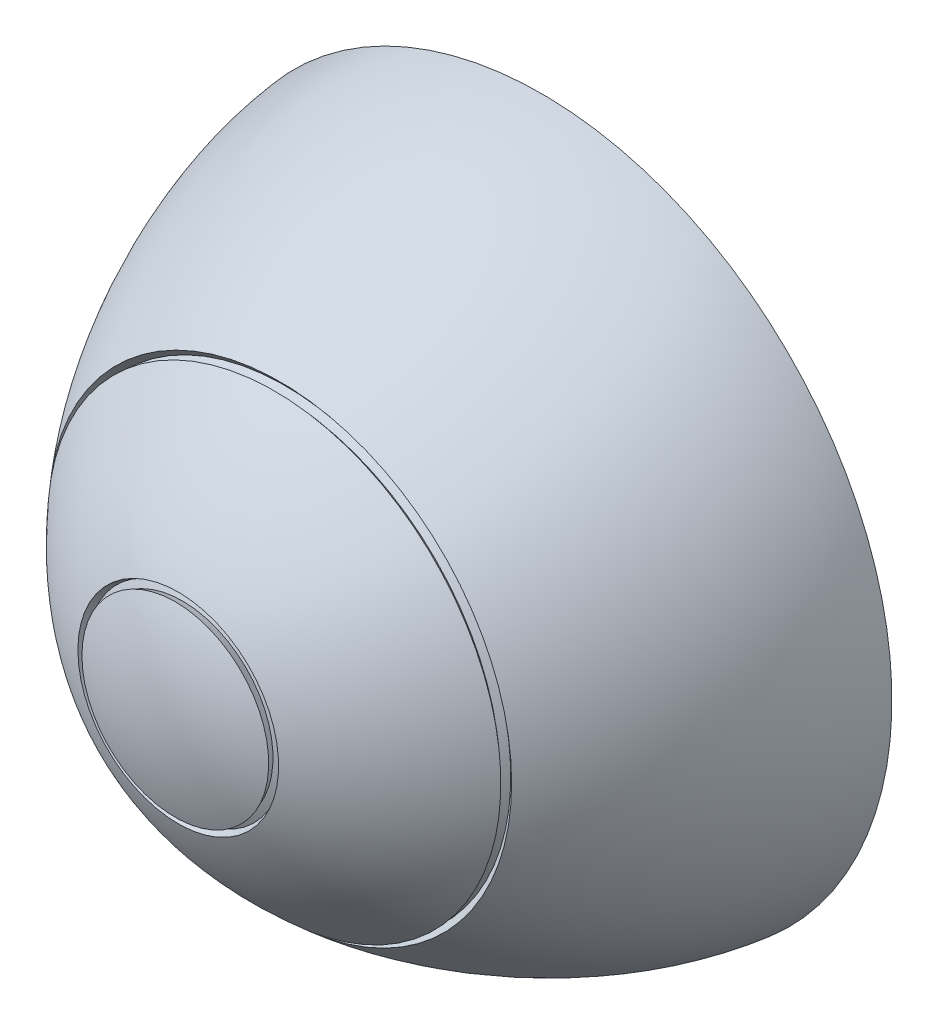
from build123d import *


with BuildPart() as part:
    # Esboço1 → Revolução1 (revolve)
    with BuildSketch(Plane(origin=(0, 0, 0), x_dir=(0, 0, -1), z_dir=(1, 0, 0))):
        with BuildLine():
            Line((-9.9, 0), (0, 0))
            Line((0, 0), (0, 9))
            add(Edge.make_bspline(
                [(-9.9, 0), (-9.909983233, 4.865844561), (-4.030430742, 8.598672438), (0, 9)],
                knots=[0, 0, 0, 0, 1, 1, 1, 1], degree=3))
        make_face()
    revolve(axis=Axis((0, 0, -0.495249581), (0, 0, 1)))

    # Esboço2 → Corte-Revolução1 (revolve, cut)
    with BuildSketch(Plane(origin=(0, 0, 0), x_dir=(0, 0, -1), z_dir=(1, 0, 0))):
        with BuildLine():
            Line((-4, 5.469953061), (-4, 0))
            Line((-4, 0), (1, 0))
            Line((1, 0), (1, 7.09390119))
            add(Edge.make_bspline(
                [(1, 7.09390119), (0.241512964, 7.01284271), (0.209991891, 7.011809212), (0.086311605, 6.997699099), (0.057571185, 6.994232877), (-0.027522658, 6.983363535), (-0.084931827, 6.975254523), (-0.257903575, 6.948559915), (-0.374697634, 6.927544949), (-0.727785948, 6.85558027), (-0.966699441, 6.795740091), (-1.684998489, 6.585696706), (-2.16561255, 6.405303013), (-3.103396143, 5.982045517), (-3.561210819, 5.739533633), (-4, 5.469953061)],
                knots=[-0.018640512, -0.018640512, -0.018640512, -0.018640512, 0.0078125, 0.0078125, 0.015625, 0.015625, 0.03125, 0.03125, 0.0625, 0.0625, 0.125, 0.125, 0.25, 0.25, 0.374605818, 0.374605818, 0.374605818, 0.374605818], degree=3))
        make_face()
    revolve(axis=Axis((0, 0, -0.495249581), (0, 0, 1)), mode=Mode.SUBTRACT)

    # Esboço4 → Corte-Revolução2 (revolve, cut)
    with BuildSketch(Plane(origin=(0, 0, 0), x_dir=(0, 0, -1), z_dir=(1, 0, 0))):
        with BuildLine():
            Line((-7.010691462, 5.975922882), (-6.746324533, 5.675729353))
            add(Edge.make_bspline(
                [(-6.6, 5.802525488), (-6.64911679, 5.760642692), (-6.697896572, 5.718377678), (-6.746324533, 5.675729353)],
                knots=[0.518643322, 0.518643322, 0.518643322, 0.518643322, 0.532269657, 0.532269657, 0.532269657, 0.532269657], degree=3))
            Line((-6.6, 5.802525488), (-6.859541532, 6.106895011))
            add(Edge.make_bspline(
                [(-6.859541532, 6.106895011), (-6.910263, 6.063645619), (-6.960651247, 6.019989162), (-7.010691462, 5.975922882)],
                knots=[0.518640951, 0.518640951, 0.518640951, 0.518640951, 0.532267119, 0.532267119, 0.532267119, 0.532267119], degree=3))
        make_face()
    revolve(axis=Axis((0, 0, -0.495249581), (0, 0, 1)), mode=Mode.SUBTRACT)

    # Esboço5 → Corte-Revolução3 (revolve, cut)
    with BuildSketch(Plane(origin=(0, 0, 0), x_dir=(0, 0, -1), z_dir=(1, 0, 0))):
        with BuildLine():
            Line((-9.528707684, 2.660294167), (-9.162349853, 2.5))
            add(Edge.make_bspline(
                [(-9.162349853, 2.5), (-9.187658731, 2.44215569), (-9.212156272, 2.384053697), (-9.235824688, 2.325698344)],
                knots=[0.601133562, 0.601133562, 0.601133562, 0.601133562, 0.63051293, 0.63051293, 0.63051293, 0.63051293], degree=3))
            Line((-9.235824688, 2.325698344), (-9.606351735, 2.475980843))
            add(Edge.make_bspline(
                [(-9.528707684, 2.660294167), (-9.555435364, 2.599167889), (-9.581323805, 2.537727857), (-9.606351735, 2.475980843)],
                knots=[0.601091643, 0.601091643, 0.601091643, 0.601091643, 0.630455711, 0.630455711, 0.630455711, 0.630455711], degree=3))
        make_face()
    revolve(axis=Axis((0, 0, -0.495249581), (0, 0, 1)), mode=Mode.SUBTRACT)


solid = part.part
